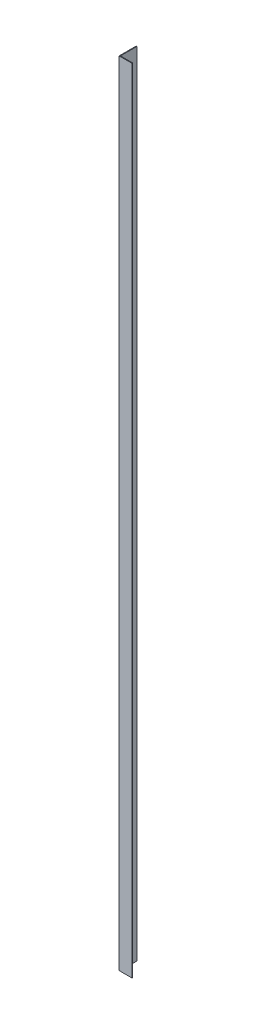
from build123d import *

# Parameters (mm, degrees)
PACK_SOVE_SAG_1_START = 120
PACK_SOVE_SAG_1_DEPTH = 1850


with BuildPart() as part:
    # Sketch1 → PACK_sove_sag_1 (new body)
    with BuildSketch(Plane(origin=(0, 0, 0), x_dir=(1, 0, 0), z_dir=(0, 1, 0)).offset(PACK_SOVE_SAG_1_START)):
        Polygon((700, -40), (700, -38.5), (671.5, -38.5), (671.5, 0), (670, 0), (670, -40), align=None)
    extrude(amount=PACK_SOVE_SAG_1_DEPTH)


solid = part.part
